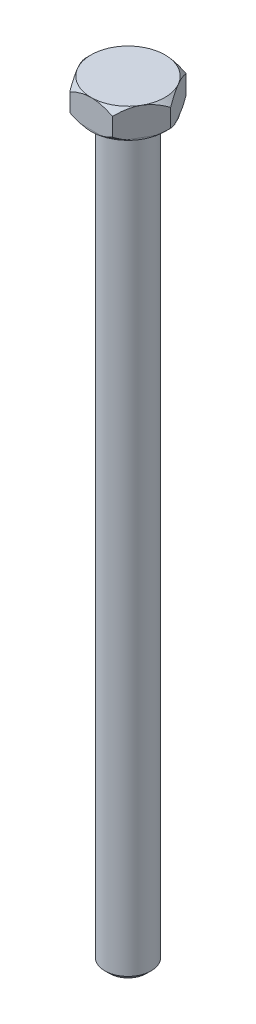
from build123d import *

# Parameters (mm, degrees)
BOSS_EXTRUDE1_DEPTH = 6.4
SKETCH2_OUTSIDE_W   = 25.528
SKETCH2_OUTSIDE_H   = 23.052
SKETCH2_OUTSIDE_R   = 8
CUT_EXTRUDE1_DEPTH  = 0.32
SKETCH3_R           = 5
BOSS_EXTRUDE2_DEPTH = 160
CHAMFER1_SIZE       = 1


with BuildPart() as part:
    # Sketch1 → Boss-Extrude1 (new body)
    with BuildSketch(Plane(origin=(0, 0, 0), x_dir=(1, 0, 0), z_dir=(0, 1, 0))):
        Polygon((9.237604307, 0), (4.618802154, 8), (-4.618802154, 8), (-9.237604307, 0), (-4.618802154, -8), (4.618802154, -8), align=None)
    extrude(amount=-BOSS_EXTRUDE1_DEPTH)

    # Sketch4 → Cut-Revolve1 (revolve, cut)
    with BuildSketch(Plane(origin=(0, 0, 0), x_dir=(0, 0, -1), z_dir=(1, 0, 0))):
        Polygon((-8, 0), (-9.237604307, 0), (-9.237604307, -1.237604307), align=None)
        Polygon((-9.237604307, -5.162395693), (-8, -6.4), (-9.237604307, -6.4), align=None)
    revolve(axis=Axis((0, 0, 0), (0, -1, 0)), mode=Mode.SUBTRACT)

    # Sketch2 outside → Cut-Extrude1 (cut)
    with BuildSketch(Plane.XZ.offset(6.4)):
        Rectangle(SKETCH2_OUTSIDE_W, SKETCH2_OUTSIDE_H)
        with Locations(Location((0, 0, 0), (0, 0, 90))):
            Circle(SKETCH2_OUTSIDE_R, mode=Mode.SUBTRACT)
    extrude(amount=-CUT_EXTRUDE1_DEPTH, mode=Mode.SUBTRACT)

    # Sketch3 → Boss-Extrude2 (add)
    with BuildSketch(Plane.XZ.offset(6.4)):
        with Locations(Location((0, 0, 0), (0, 0, 90))):
            Circle(SKETCH3_R)
    extrude(amount=BOSS_EXTRUDE2_DEPTH)

    # Chamfer1
    chamfer1_edges = [part.edges().sort_by_distance(p)[0] for p in [
        (0, -166.4, -5),
    ]]
    chamfer(chamfer1_edges, length=CHAMFER1_SIZE)


solid = part.part
